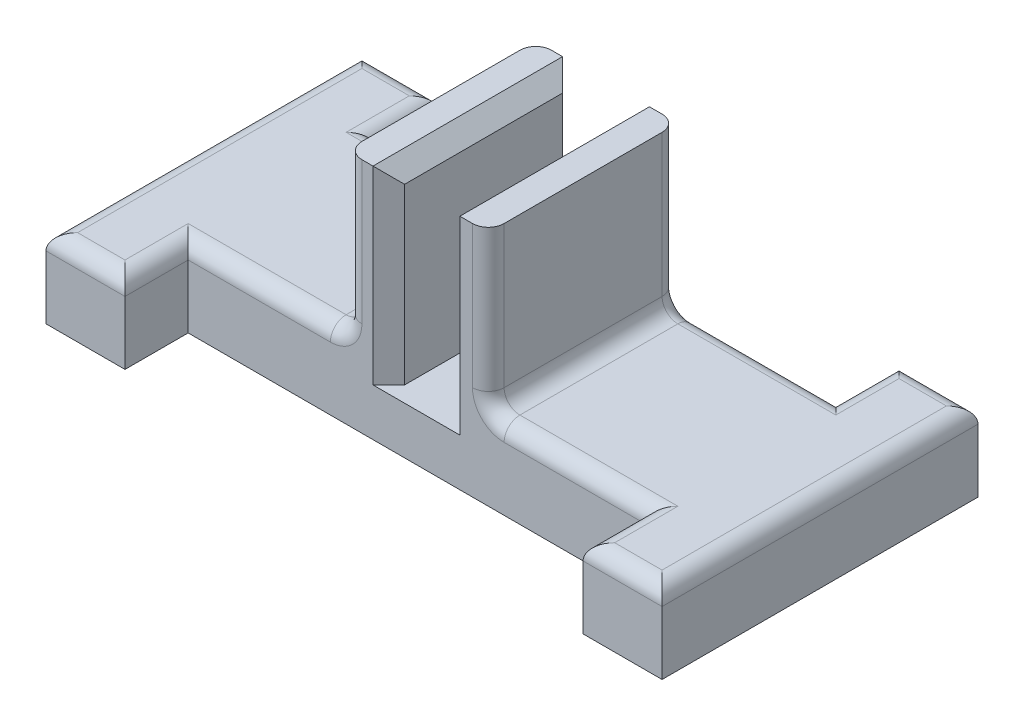
from build123d import *

# Parameters (mm, degrees)
SKETCH1_W           = 9
SKETCH1_H           = 15
SKETCH1_W_2         = 15
SKETCH1_H_2         = 5
BOSS_EXTRUDE1_DEPTH = 12
SKETCH2_W           = 3.5
SKETCH2_H           = 12
CUT_EXTRUDE1_DEPTH  = 12
SKETCH3_W           = 20
SKETCH3_H           = 5
BOSS_EXTRUDE2_DEPTH = 5
SKETCH4_W           = 20
SKETCH4_H           = 5
BOSS_EXTRUDE3_DEPTH = 5
CHAMFER1_SIZE       = 1
FILLET1_R           = 1


with BuildPart() as part:
    # Sketch1 → Boss-Extrude1 (new body)
    with BuildSketch(Plane.XY):
        Rectangle(SKETCH1_W, SKETCH1_H)
        with Locations((-12, -5)):
            Rectangle(SKETCH1_W_2, SKETCH1_H_2)
        with Locations((12, -5)):
            Rectangle(SKETCH1_W_2, SKETCH1_H_2)
    extrude(amount=BOSS_EXTRUDE1_DEPTH)

    # Sketch2 → Cut-Extrude1 (cut)
    with BuildSketch(Plane(origin=(0, 7.5, 0), x_dir=(1, 0, 0), z_dir=(0, 1, 0))):
        with Locations((-0.05, -6)):
            Rectangle(SKETCH2_W, SKETCH2_H)
    extrude(amount=-CUT_EXTRUDE1_DEPTH, mode=Mode.SUBTRACT)

    # Sketch3 → Boss-Extrude2 (add)
    with BuildSketch(Plane.ZY.offset(19.5)):
        with Locations((6, -5)):
            Rectangle(SKETCH3_W, SKETCH3_H)
    extrude(amount=-BOSS_EXTRUDE2_DEPTH)

    # Sketch4 → Boss-Extrude3 (add)
    with BuildSketch(Plane(origin=(19.5, 0, 0), x_dir=(0, 0, -1), z_dir=(1, 0, 0))):
        with Locations((-6, -5)):
            Rectangle(SKETCH4_W, SKETCH4_H)
    extrude(amount=-BOSS_EXTRUDE3_DEPTH)

    # Chamfer1
    chamfer1_edges = [part.edges().sort_by_distance(p)[0] for p in [
        (-1.8, 1.5, 12),
        (-1.8, 1.5, 0),
        (1.7, 1.5, 0),
        (1.7, 1.5, 12),
        (-1.8, 7.5, 6),
        (1.7, 7.5, 6),
    ]]
    chamfer(chamfer1_edges, length=CHAMFER1_SIZE)

    # Fillet1
    fillet1_edges = [part.edges().sort_by_distance(p)[0] for p in [
        (9.5, -2.5, 0),
        (-9.5, -2.5, 0),
        (-4.5, 2.5, 0),
        (4.5, 2.5, 0),
        (-4.5, 2.5, 12),
        (4.5, -2.5, 6),
        (19.5, -2.5, 6),
        (-19.5, -2.5, 6),
        (-4.5, -2.5, 6),
        (-9.5, -2.5, 12),
        (9.5, -2.5, 12),
        (-14.5, -2.5, -2),
        (4.5, 2.5, 12),
        (-17, -2.5, -4),
        (-14.5, -2.5, 14),
        (-17, -2.5, 16),
        (14.5, -2.5, -2),
        (14.5, -2.5, 14),
        (17, -2.5, 16),
        (17, -2.5, -4),
    ]]
    fillet(fillet1_edges, radius=FILLET1_R)


solid = part.part
